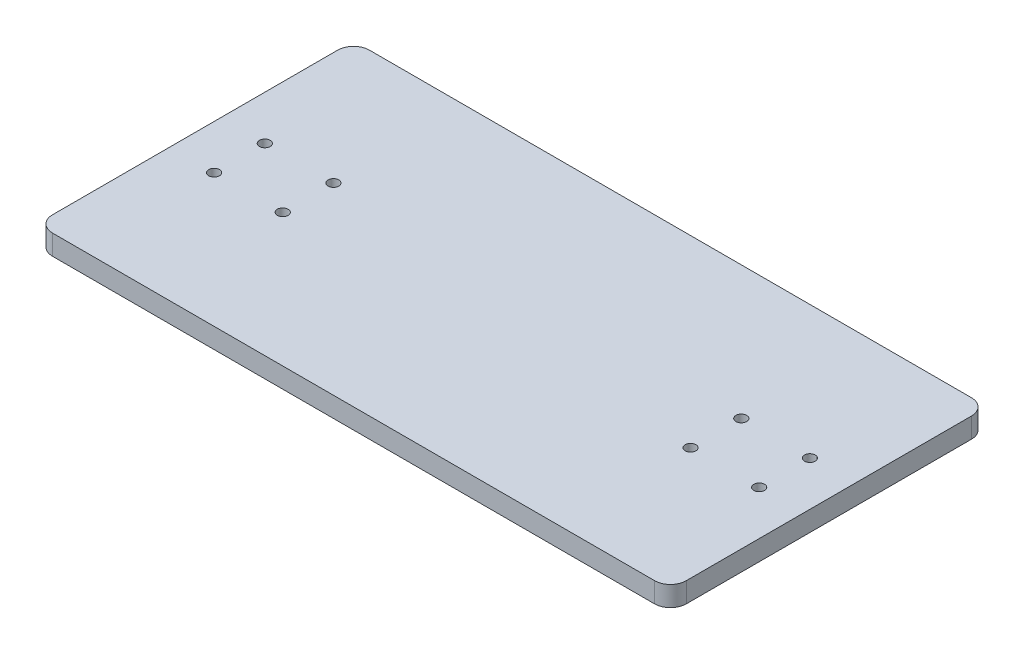
from build123d import *

# Parameters (mm, degrees)
SKETCH1_W           = 200
SKETCH1_H           = 100
SKETCH1_R           = 1.7
BOSS_EXTRUDE1_DEPTH = 6.35
FILLET1_R           = 5


with BuildPart() as part:
    # Sketch1 → Boss-Extrude1 (new body)
    with BuildSketch(Plane(origin=(0, 0, 0), x_dir=(1, 0, 0), z_dir=(0, 1, 0))):
        Rectangle(SKETCH1_W, SKETCH1_H)
        with Locations(Location((-86, 8, 0), (0, 0, 270))):
            Circle(SKETCH1_R, mode=Mode.SUBTRACT)
        with Locations(Location((-86, -8, 0), (0, 0, 90))):
            Circle(SKETCH1_R, mode=Mode.SUBTRACT)
        with Locations(Location((86, -8, 0), (0, 0, 270))):
            Circle(SKETCH1_R, mode=Mode.SUBTRACT)
        with Locations(Location((86, 8, 0), (0, 0, 90))):
            Circle(SKETCH1_R, mode=Mode.SUBTRACT)
        with Locations(Location((-64.35, 8, 0), (0, 0, 270))):
            Circle(SKETCH1_R, mode=Mode.SUBTRACT)
        with Locations(Location((-64.35, -8, 0), (0, 0, 90))):
            Circle(SKETCH1_R, mode=Mode.SUBTRACT)
        with Locations(Location((64.35, -8, 0), (0, 0, 270))):
            Circle(SKETCH1_R, mode=Mode.SUBTRACT)
        with Locations(Location((64.35, 8, 0), (0, 0, 90))):
            Circle(SKETCH1_R, mode=Mode.SUBTRACT)
    extrude(amount=BOSS_EXTRUDE1_DEPTH)

    # Fillet1
    fillet1_edges = [part.edges().sort_by_distance(p)[0] for p in [
        (-100, 3.175, -50),
        (100, 3.175, -50),
        (100, 3.175, 50),
        (-100, 3.175, 50),
    ]]
    fillet(fillet1_edges, radius=FILLET1_R)


solid = part.part
